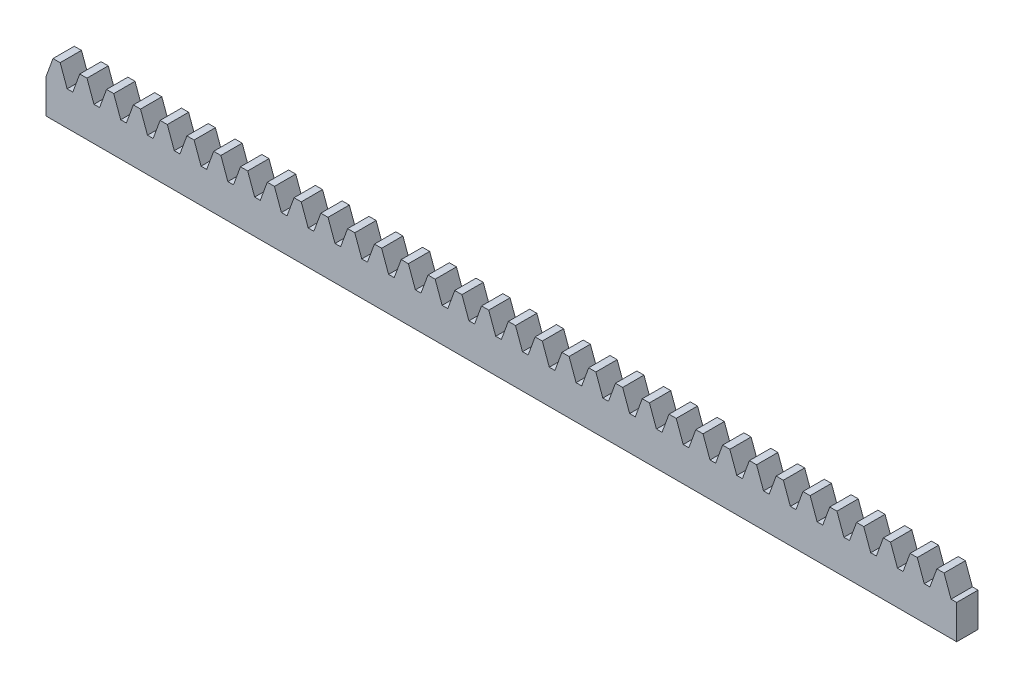
from build123d import *

# Parameters (mm, degrees)
SKETCH1_W       = 213.628300444
SKETCH1_H       = 8
EXTRUDE1_DEPTH  = 5
EXTRUDE2_DEPTH  = 5
LPATTERN1_COUNT = 34
LPATTERN1_PITCH = 6.283185307


with BuildPart() as part:
    # Sketch1 → Extrude1 (new body)
    with BuildSketch(Plane.XY):
        with Locations((106.814150222, -4)):
            Rectangle(SKETCH1_W, SKETCH1_H)
    extrude(amount=EXTRUDE1_DEPTH)

    # Sketch2 → Extrude2 (add)
    with BuildSketch(Plane.XY.offset(5)):
        Polygon((0, 0), (1.637866054, 4.5), (3.323577771, 4.5), (4.961443825, 0), align=None)
    extrude2 = extrude(amount=-EXTRUDE2_DEPTH)

    # LPattern1: Extrude2 ×34
    with Locations(*[(i * LPATTERN1_PITCH, 0, 0) for i in range(1, LPATTERN1_COUNT)]):
        add(extrude2)


solid = part.part
